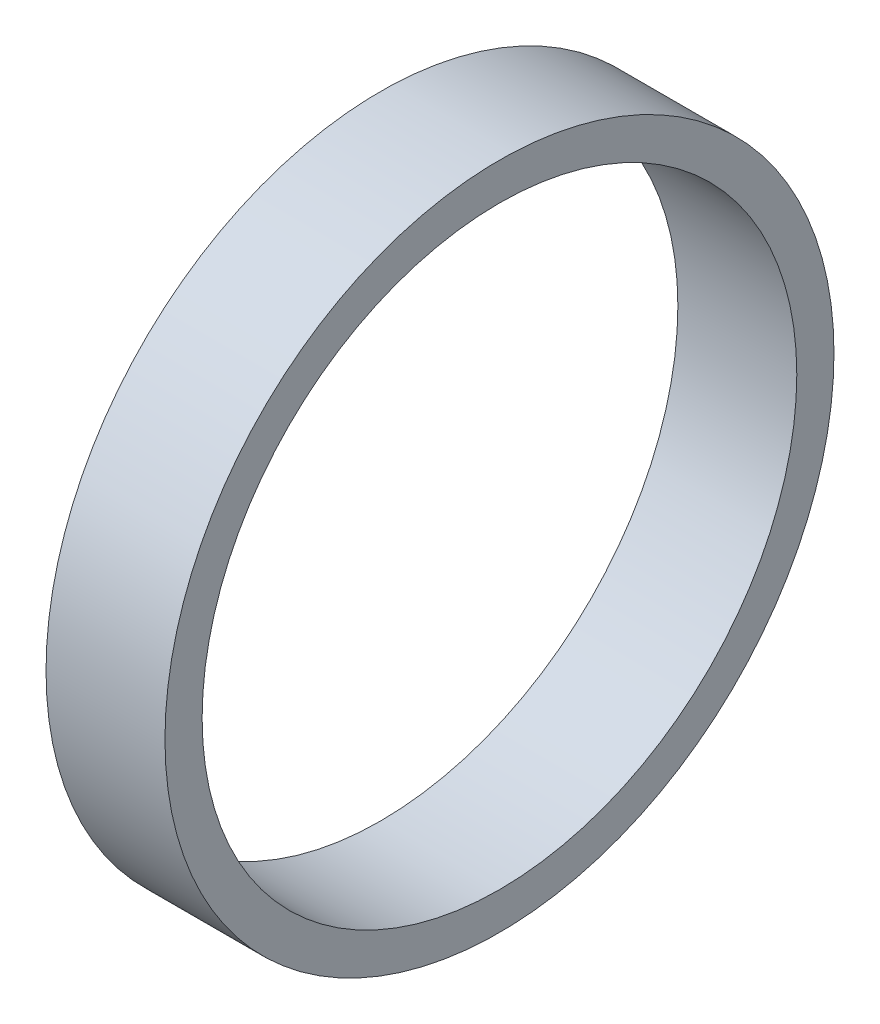
from build123d import *

# Parameters (mm, degrees)
SKETCH1_R           = 14.2875
SKETCH1_R_2         = 12.7
BOSS_EXTRUDE1_DEPTH = 5.08


with BuildPart() as part:
    # Sketch1 → Boss-Extrude1 (new body)
    with BuildSketch(Plane(origin=(0, 0, 0), x_dir=(0, 0, -1), z_dir=(1, 0, 0))):
        Circle(SKETCH1_R)
        Circle(SKETCH1_R_2, mode=Mode.SUBTRACT)
    extrude(amount=BOSS_EXTRUDE1_DEPTH)


solid = part.part
